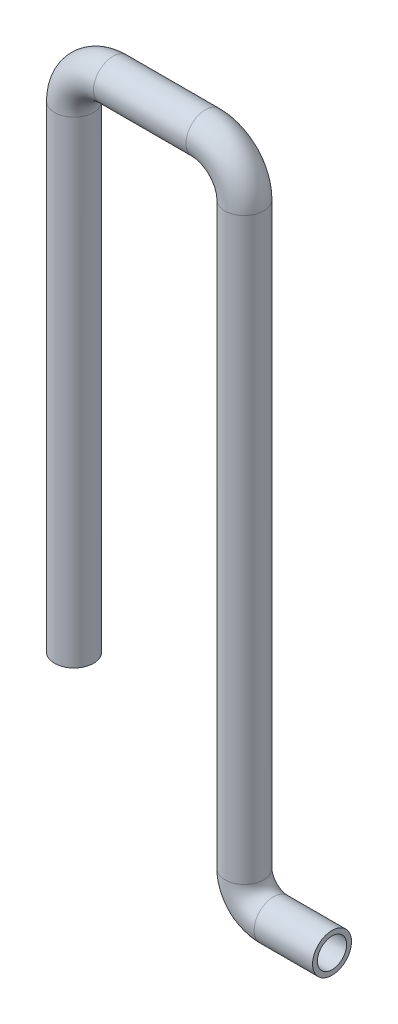
from build123d import *

# Parameters (mm, degrees)
TUBE_PROFILE_R   = 4
TUBE_PROFILE_R_2 = 3


with BuildPart() as part:
    # Tube: sweep along a curve in space
    with BuildLine() as tube_path:
        Line((-145, 44, 95), (-145, 142, 95))
        ThreePointArc((-137, 150, 95), (-142.656854249, 147.656854249, 95), (-145, 142, 95))
        Line((-137, 150, 95), (-118, 150, 95))
        ThreePointArc((-110, 142, 95), (-112.343145751, 147.656854249, 95), (-118, 150, 95))
        Line((-110, 142, 95), (-110, 23, 95))
        ThreePointArc((-104, 17, 95), (-108.242640687, 18.757359313, 95), (-110, 23, 95))
        Line((-104, 17, 95), (-92, 17, 95))
    # Tube profile (on start of the path) → Tube (sweep)
    with BuildSketch(Plane(origin=(-145, 44, 95), x_dir=(0, 0, 1), z_dir=(0, 1, 0))):
        Circle(TUBE_PROFILE_R)
        Circle(TUBE_PROFILE_R_2, mode=Mode.SUBTRACT)
    sweep(path=tube_path.line)


solid = part.part
